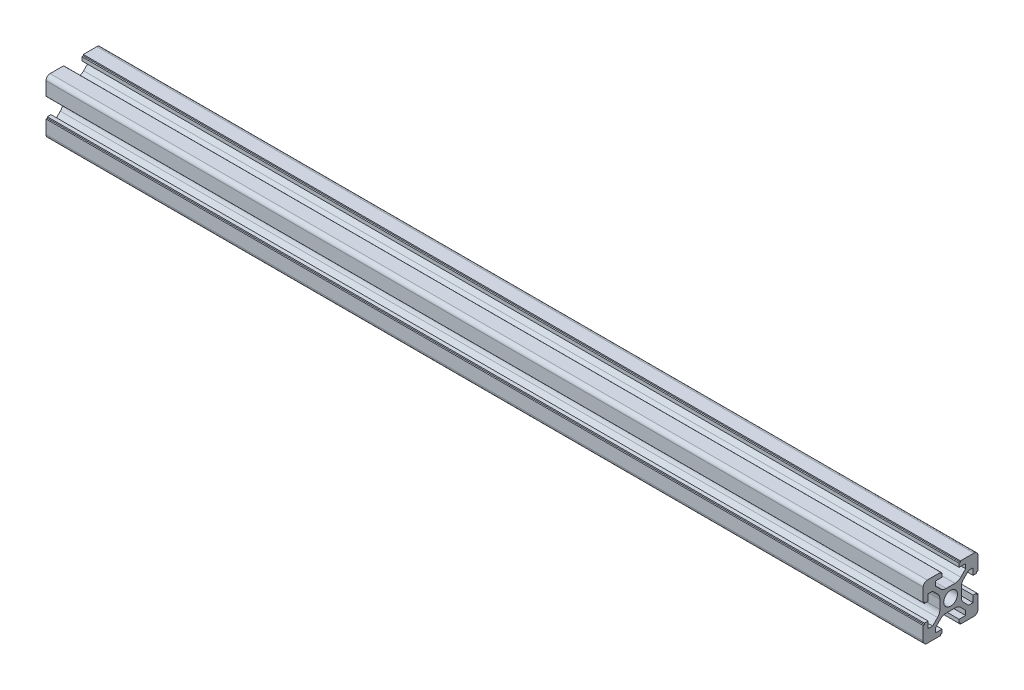
from build123d import *

# Parameters (mm, degrees)
EXTRUDE_1_DEPTH = 320
FILLET_1_R      = 1.5
FILLET_2_R      = 3


with BuildPart() as part:
    # 草图1 → 凸台-拉伸1 (new body)
    with BuildSketch(Plane(origin=(0, 0, 0), x_dir=(0, 0, -1), z_dir=(1, 0, 0))):
        Polygon((-10, 10), (-10, 3.6), (-9.530955747, 3.6), (-9.530955747, 3.1), (-8.2, 3.1), (-8.2, 5.5), (-6.560660172, 5.5), (-3.9, 2.839339828), (-3.9, 0), (-3.9, -2.839339828), (-6.560660172, -5.5), (-8.2, -5.5), (-8.2, -3.1), (-9.530955747, -3.1), (-9.530955747, -3.6), (-10, -3.6), (-10, -10), (-3.6, -10), (-3.6, -9.530955747), (-3.1, -9.530955747), (-3.1, -8.2), (-5.5, -8.2), (-5.5, -6.560660172), (-2.839339828, -3.9), (0, -3.9), (2.839339828, -3.9), (5.5, -6.560660172), (5.5, -8.2), (3.1, -8.2), (3.1, -9.530955747), (3.6, -9.530955747), (3.6, -10), (10, -10), (10, -3.6), (9.530955747, -3.6), (9.530955747, -3.1), (8.2, -3.1), (8.2, -5.5), (6.560660172, -5.5), (3.9, -2.839339828), (3.9, 0), (3.9, 2.839339828), (6.560660172, 5.5), (8.2, 5.5), (8.2, 3.1), (9.530955747, 3.1), (9.530955747, 3.6), (10, 3.6), (10, 10), (3.6, 10), (3.6, 9.530955747), (3.1, 9.530955747), (3.1, 8.2), (5.5, 8.2), (5.5, 6.560660172), (2.839339828, 3.9), (0, 3.9), (-2.839339828, 3.9), (-5.5, 6.560660172), (-5.5, 8.2), (-3.1, 8.2), (-3.1, 9.530955747), (-3.6, 9.530955747), (-3.6, 10), align=None)
        with BuildLine():
            ThreePointArc((0, 2.5), (-1.767766953, 1.767766953), (-2.5, 0))
            ThreePointArc((-2.5, 0), (-1.767766953, -1.767766953), (0, -2.5))
            ThreePointArc((0, -2.5), (1.767766953, -1.767766953), (2.5, 0))
            ThreePointArc((2.5, 0), (1.767766953, 1.767766953), (0, 2.5))
        make_face(mode=Mode.SUBTRACT)
    extrude(amount=EXTRUDE_1_DEPTH)

    # 圆角1
    fillet_1_edges = [part.edges().sort_by_distance(p)[0] for p in [
        (160, -10, -10),
        (160, -10, 10),
        (160, 10, 10),
        (160, 10, -10),
    ]]
    fillet(fillet_1_edges, radius=FILLET_1_R)

    # 圆角2
    fillet_2_edges = [part.edges().sort_by_distance(p)[0] for p in [
        (160, -3.9, -2.839339828),
        (160, -3.9, 2.839339828),
        (160, -2.839339828, 3.9),
        (160, 2.839339828, 3.9),
        (160, 3.9, 2.839339828),
        (160, 3.9, -2.839339828),
        (160, 2.839339828, -3.9),
        (160, -2.839339828, -3.9),
    ]]
    fillet(fillet_2_edges, radius=FILLET_2_R)


solid = part.part
